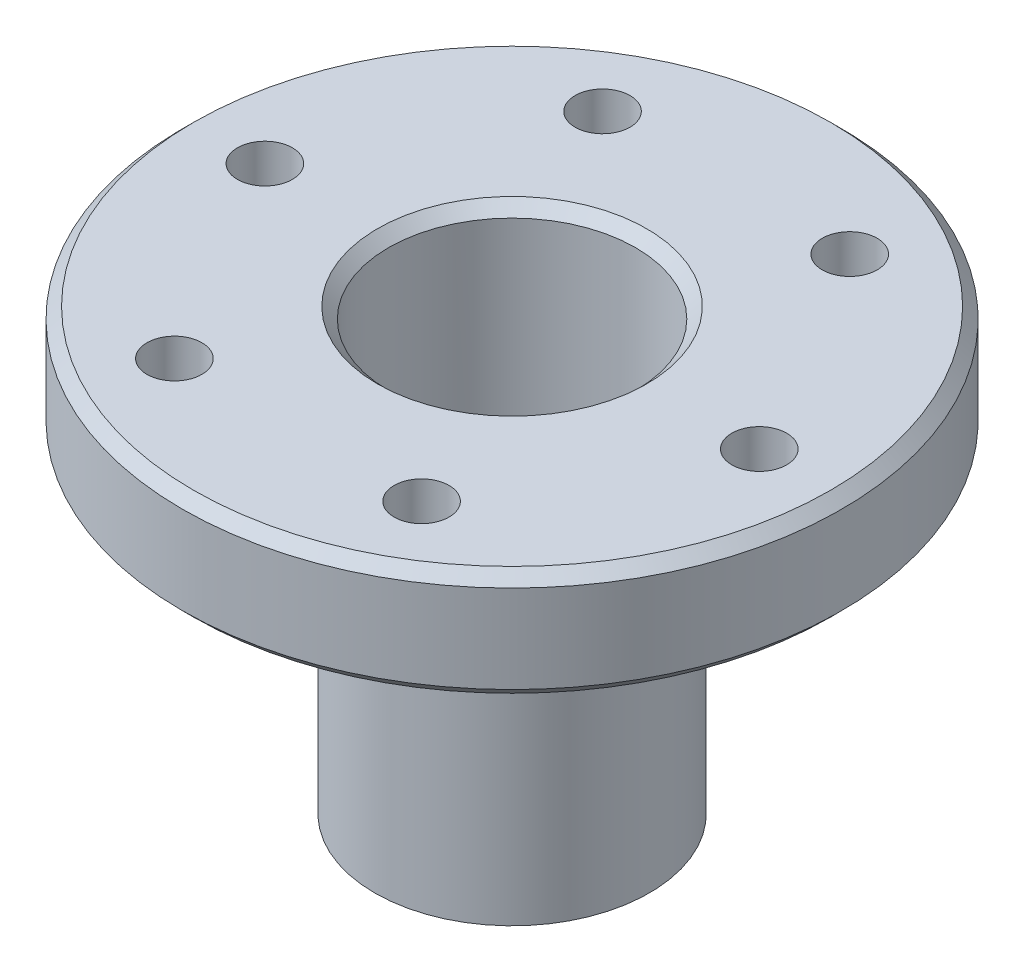
from build123d import *

# Parameters (mm, degrees)
SKETCH2_R           = 60
SKETCH2_R_2         = 22.5
SKETCH2_R_3         = 5
BOSS_EXTRUDE1_DEPTH = 20
CHAMFER1_SIZE       = 2
CHAMFER2_SIZE       = 2
SKETCH3_R           = 25
BOSS_EXTRUDE2_DEPTH = 60
FILLET1_R           = 3
CUT_EXTRUDE1_START  = -60
SKETCH2_2_R         = 22.5
CUT_EXTRUDE1_DEPTH  = 60
CHAMFER3_SIZE       = 2
CHAMFER4_SIZE       = 2


with BuildPart() as part:
    # Sketch2 → Boss-Extrude1 (new body)
    with BuildSketch(Plane(origin=(0, 0, 0), x_dir=(1, 0, 0), z_dir=(0, 1, 0))):
        Circle(SKETCH2_R)
        Circle(SKETCH2_R_2, mode=Mode.SUBTRACT)
        with Locations((45, 0)):
            Circle(SKETCH2_R_3, mode=Mode.SUBTRACT)
        with Locations((22.5, -38.97114317)):
            Circle(SKETCH2_R_3, mode=Mode.SUBTRACT)
        with Locations((-22.5, -38.97114317)):
            Circle(SKETCH2_R_3, mode=Mode.SUBTRACT)
        with Locations((-45, 0)):
            Circle(SKETCH2_R_3, mode=Mode.SUBTRACT)
        with Locations((-22.5, 38.97114317)):
            Circle(SKETCH2_R_3, mode=Mode.SUBTRACT)
        with Locations((22.5, 38.97114317)):
            Circle(SKETCH2_R_3, mode=Mode.SUBTRACT)
    extrude(amount=BOSS_EXTRUDE1_DEPTH)

    # Chamfer1
    chamfer1_edges = [part.edges().sort_by_distance(p)[0] for p in [
        (-60, 20, 0),
    ]]
    chamfer(chamfer1_edges, length=CHAMFER1_SIZE)

    # Chamfer2
    chamfer2_edges = [part.edges().sort_by_distance(p)[0] for p in [
        (-22.5, 20, 0),
    ]]
    chamfer(chamfer2_edges, length=CHAMFER2_SIZE)

    # Sketch3 → Boss-Extrude2 (add)
    with BuildSketch(Plane(origin=(0, 0, 0), x_dir=(-1, 0, 0), z_dir=(0, -1, 0))):
        Circle(SKETCH3_R)
    extrude(amount=BOSS_EXTRUDE2_DEPTH)

    # Fillet1
    fillet1_edges = [part.edges().sort_by_distance(p)[0] for p in [
        (25, 0, 0),
    ]]
    fillet(fillet1_edges, radius=FILLET1_R)

    # Sketch2<2> → Cut-Extrude1 (cut)
    with BuildSketch(Plane(origin=(0, 0, 0), x_dir=(1, 0, 0), z_dir=(0, 1, 0)).offset(CUT_EXTRUDE1_START)):
        Circle(SKETCH2_2_R)
    extrude(amount=CUT_EXTRUDE1_DEPTH, mode=Mode.SUBTRACT)

    # Chamfer3
    chamfer3_edges = [part.edges().sort_by_distance(p)[0] for p in [
        (-22.5, -60, 0),
    ]]
    chamfer(chamfer3_edges, length=CHAMFER3_SIZE)

    # Chamfer4
    chamfer4_edges = [part.edges().sort_by_distance(p)[0] for p in [
        (-60, 0, 0),
    ]]
    chamfer(chamfer4_edges, length=CHAMFER4_SIZE)


solid = part.part
